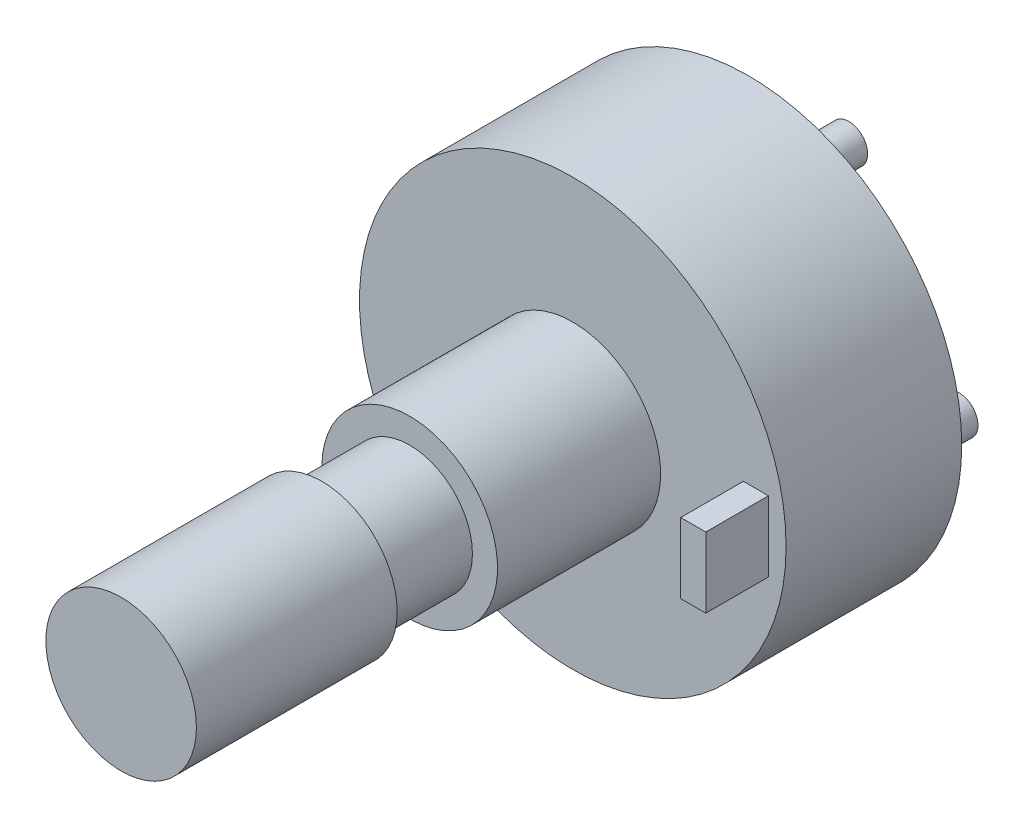
from build123d import *

# Parameters (mm, degrees)
SKETCH_1_R          = 8.5
EXTRUDE_1_DEPTH     = 7
SKETCH_4_W          = 1
SKETCH_4_H          = 2.8
EXTRUDE_4_DEPTH     = 2.5
SKETCH_5_R          = 3.5
EXTRUDE_5_DEPTH     = 6.5
SKETCH_6_R          = 2.5
EXTRUDE_6_DEPTH     = 3.5
SKETCH_7_R          = 3
EXTRUDE_7_DEPTH     = 8
SKETCH_8_R          = 0.75
EXTRUDE_8_DEPTH     = 4
CUT_EXTRUDE_1_DEPTH = 0.1


with BuildPart() as part:
    # Эскиз1 → Вытянуть1 (new body)
    with BuildSketch(Plane.XY):
        Circle(SKETCH_1_R)
    extrude(amount=EXTRUDE_1_DEPTH)

    # Эскиз4 → Вытянуть4 (add)
    with BuildSketch(Plane.XY.offset(7)):
        with Locations((7.3, 0)):
            Rectangle(SKETCH_4_W, SKETCH_4_H)
    extrude(amount=EXTRUDE_4_DEPTH)

    # Эскиз5 → Вытянуть5 (add)
    with BuildSketch(Plane.XY.offset(7)):
        with Locations(Location((0, 0, 0), (0, 0, 180))):
            Circle(SKETCH_5_R)
    extrude(amount=EXTRUDE_5_DEPTH)

    # Эскиз6 → Вытянуть6 (add)
    with BuildSketch(Plane.XY.offset(13.5)):
        Circle(SKETCH_6_R)
    extrude(amount=EXTRUDE_6_DEPTH)

    # Эскиз7 → Вытянуть7 (add)
    with BuildSketch(Plane.XY.offset(17)):
        Circle(SKETCH_7_R)
    extrude(amount=EXTRUDE_7_DEPTH)

    # Эскиз8 → Вытянуть8 (add)
    with BuildSketch(Plane(origin=(0, 0, 0), x_dir=(-1, 0, 0), z_dir=(0, 0, -1))):
        with Locations(Location((0, 4.170637875, 0), (0, 0, 180))):
            Circle(SKETCH_8_R)
        with Locations(Location((4.398665233, -2.996152892, 0), (0, 0, 180))):
            Circle(SKETCH_8_R)
        with Locations(Location((-4.398665233, -2.996152892, 0), (0, 0, 180))):
            Circle(SKETCH_8_R)
    extrude(amount=EXTRUDE_8_DEPTH)

    # Эскиз9 → Вырез-Вытянуть1 (cut)
    with BuildSketch(Plane(origin=(0, 0, 0), x_dir=(-1, 0, 0), z_dir=(0, 0, -1))):
        with BuildLine():
            add(Edge.make_bspline(
                [(2.713797769, -3.972631354), (2.713515603, -3.980128464), (2.71297592, -3.994467774), (2.707695876, -4.014784457), (2.699320857, -4.033055702), (2.690950559, -4.043171243), (2.686770742, -4.04822257)],
                knots=[0, 0, 0, 0, 1.092637599, 2.089827516, 3.046130571, 4, 4, 4, 4], degree=3))
            add(Edge.make_bspline(
                [(2.686770742, -4.04822257), (2.682257107, -4.051930552), (2.673257572, -4.059323731), (2.657035359, -4.067214277), (2.638674751, -4.071153076), (2.625835353, -4.071905073), (2.619203175, -4.072293516)],
                knots=[0, 0, 0, 0, 0.952479984, 1.899107072, 2.914785828, 4, 4, 4, 4], degree=3))
            add(Edge.make_bspline(
                [(2.619203175, -4.072293516), (2.612973782, -4.071971759), (2.600895193, -4.071347884), (2.583488342, -4.066360283), (2.567179902, -4.05878394), (2.552464646, -4.047805267), (2.539755174, -4.033685028), (2.531008825, -4.01586549), (2.52530447, -3.995220353), (2.524848394, -3.980415867), (2.52460858, -3.972631354)],
                knots=[0, 0, 0, 0, 0.965224369, 1.871538615, 2.790145089, 3.742676772, 4.702446452, 5.708824282, 6.795250981, 8, 8, 8, 8], degree=3))
            Line((2.52460858, -3.972631354), (2.52460858, -2.416043516))
            Line((2.52460858, -2.416043516), (2.282209931, -2.645773245))
            add(Edge.make_bspline(
                [(2.282209931, -2.645773245), (2.276900692, -2.650406319), (2.266682327, -2.659323308), (2.248447833, -2.668158896), (2.229582564, -2.674608161), (2.216246052, -2.675092019), (2.209574796, -2.675334056)],
                knots=[0, 0, 0, 0, 1.047830234, 2.016694027, 3.007900926, 4, 4, 4, 4], degree=3))
            add(Edge.make_bspline(
                [(2.209574796, -2.675334056), (2.203327317, -2.675070597), (2.19055066, -2.674531799), (2.171860071, -2.667893796), (2.152969967, -2.658813277), (2.141580254, -2.649948716), (2.135672769, -2.645350948)],
                knots=[0, 0, 0, 0, 0.917779654, 1.876941996, 2.898836826, 4, 4, 4, 4], degree=3))
            add(Edge.make_bspline(
                [(2.135672769, -2.645350948), (2.13065196, -2.640186587), (2.121037938, -2.630297687), (2.110726638, -2.612816415), (2.103879259, -2.594330043), (2.103117491, -2.58136257), (2.10273358, -2.574827299)],
                knots=[0, 0, 0, 0, 1.076594581, 2.061500984, 3.023046599, 4, 4, 4, 4], degree=3))
            add(Edge.make_bspline(
                [(2.10273358, -2.574827299), (2.103206534, -2.569014859), (2.104161096, -2.557283629), (2.110066446, -2.539721294), (2.119858566, -2.522544237), (2.128604791, -2.511921927), (2.133138985, -2.506415137)],
                knots=[0, 0, 0, 0, 0.912890005, 1.842483027, 2.881505822, 4, 4, 4, 4], degree=3))
            Line((2.133138985, -2.506415137), (2.540655877, -2.109455678))
            add(Edge.make_bspline(
                [(2.540655877, -2.109455678), (2.547401488, -2.103347599), (2.560496415, -2.091490281), (2.582312439, -2.077288688), (2.605825737, -2.067044275), (2.622618562, -2.066039764), (2.631027499, -2.065536759)],
                knots=[0, 0, 0, 0, 1.058271981, 2.054372069, 3.025734895, 4, 4, 4, 4], degree=3))
            add(Edge.make_bspline(
                [(2.631027499, -2.065536759), (2.635311683, -2.065856875), (2.644670117, -2.066556141), (2.658565291, -2.07339881), (2.673949136, -2.08250867), (2.683661424, -2.090970983), (2.688882229, -2.095519867)],
                knots=[0, 0, 0, 0, 0.76941324, 1.680717673, 2.753278471, 4, 4, 4, 4], degree=3))
            add(Edge.make_bspline(
                [(2.688882229, -2.095519867), (2.692815035, -2.101001936), (2.70089675, -2.112267309), (2.708074678, -2.132673895), (2.712876615, -2.155257484), (2.713481802, -2.171221987), (2.713797769, -2.179557029)],
                knots=[0, 0, 0, 0, 0.903116982, 1.855859341, 2.880547435, 4, 4, 4, 4], degree=3))
            Line((2.713797769, -2.179557029), (2.713797769, -3.972631354))
        make_face()
        with BuildLine():
            Line((0.641683211, 1.982951696), (-0.004431654, 0.946634129))
            Line((-0.004431654, 0.946634129), (0.614233886, 0.946634129))
            add(Edge.make_bspline(
                [(0.614233886, 0.946634129), (0.620887476, 0.946349382), (0.634012747, 0.945787673), (0.652923053, 0.94010725), (0.670037799, 0.930571412), (0.685212067, 0.917934476), (0.697449599, 0.902971967), (0.707288107, 0.88712087), (0.713009099, 0.869875765), (0.713600093, 0.857991084), (0.713896048, 0.852039534)],
                knots=[0, 0, 0, 0, 1.049035914, 2.069391155, 3.084643979, 4.126821057, 5.168998136, 6.1263312, 7.061713754, 8, 8, 8, 8], degree=3))
            add(Edge.make_bspline(
                [(0.713896048, 0.852039534), (0.712495652, 0.841126977), (0.709523342, 0.817965317), (0.693423108, 0.792035209), (0.675522305, 0.773936077), (0.657673957, 0.764090738), (0.636781872, 0.758715413), (0.622007833, 0.757882965), (0.614233886, 0.757444939)],
                knots=[0, 0, 0, 0, 1.282713716, 2.722531535, 3.483677017, 4.262097154, 5.085533406, 6, 6, 6, 6], degree=3))
            Line((0.614233886, 0.757444939), (-0.183908006, 0.757444939))
            add(Edge.make_bspline(
                [(-0.183908006, 0.757444939), (-0.192372088, 0.757647702), (-0.208271481, 0.758028583), (-0.230581277, 0.76187034), (-0.249722252, 0.767896201), (-0.265520067, 0.776913414), (-0.277641635, 0.788573054), (-0.286551464, 0.802702772), (-0.291591058, 0.819615862), (-0.292146543, 0.831735633), (-0.292438411, 0.838103723)],
                knots=[0, 0, 0, 0, 1.318247643, 2.476267915, 3.517133912, 4.431675526, 5.285213851, 6.113267656, 7.008654443, 8, 8, 8, 8], degree=3))
            add(Edge.make_bspline(
                [(-0.292438411, 0.838103723), (-0.292055365, 0.843622383), (-0.291248119, 0.855252606), (-0.286125741, 0.873223108), (-0.278497025, 0.892739161), (-0.271604396, 0.905876083), (-0.267945168, 0.912850345)],
                knots=[0, 0, 0, 0, 0.834498753, 1.75865294, 2.810090946, 4, 4, 4, 4], degree=3))
            Line((-0.267945168, 0.912850345), (0.479098751, 2.096971966))
            add(Edge.make_bspline(
                [(0.479098751, 2.096971966), (0.484867325, 2.109813061), (0.496132299, 2.13488938), (0.507910628, 2.173284279), (0.514946395, 2.210876619), (0.516111421, 2.235598648), (0.516683211, 2.247732102)],
                knots=[0, 0, 0, 0, 1.077976984, 2.105092662, 3.069988531, 4, 4, 4, 4], degree=3))
            add(Edge.make_bspline(
                [(0.516683211, 2.247732102), (0.516321365, 2.258303389), (0.515603852, 2.279265454), (0.511007365, 2.310193512), (0.502740283, 2.339965331), (0.491921529, 2.368852071), (0.477343944, 2.396336173), (0.459855478, 2.422818733), (0.439082453, 2.448182836), (0.423353408, 2.463937403), (0.415331859, 2.471971966)],
                knots=[0, 0, 0, 0, 1.001356293, 1.985614019, 2.952654674, 3.923273066, 4.901280323, 5.892287325, 6.925101988, 8, 8, 8, 8], degree=3))
            add(Edge.make_bspline(
                [(0.415331859, 2.471971966), (0.39863939, 2.485899454), (0.364787719, 2.514143853), (0.314608129, 2.538944217), (0.271792217, 2.553990902), (0.238063864, 2.562620209), (0.20290237, 2.567198172), (0.179139062, 2.56789858), (0.167021048, 2.56825575)],
                knots=[0, 0, 0, 0, 1.432193878, 2.904432902, 3.663213759, 4.430043462, 5.199406286, 6, 6, 6, 6], degree=3))
            add(Edge.make_bspline(
                [(0.167021048, 2.56825575), (0.154308321, 2.567786875), (0.128936105, 2.566851087), (0.091559916, 2.558690243), (0.054552236, 2.546705487), (0.031445143, 2.53441629), (0.019639292, 2.528137507)],
                knots=[0, 0, 0, 0, 0.986895246, 1.969657644, 2.962659636, 4, 4, 4, 4], degree=3))
            add(Edge.make_bspline(
                [(0.019639292, 2.528137507), (0.008177789, 2.520517249), (-0.014678314, 2.505321213), (-0.045334014, 2.477867872), (-0.073760497, 2.448022055), (-0.089449582, 2.425460006), (-0.09733706, 2.414117237)],
                knots=[0, 0, 0, 0, 1.002390868, 1.998930695, 2.993989149, 4, 4, 4, 4], degree=3))
            add(Edge.make_bspline(
                [(-0.09733706, 2.414117237), (-0.102267744, 2.407763943), (-0.113231001, 2.393637548), (-0.128312215, 2.383966044), (-0.136610708, 2.378644264)],
                knots=[0, 0, 0, 0, 0.899492679, 2, 2, 2, 2], degree=3))
            Line((-0.136610708, 2.378644264), (-0.181374222, 2.368509129))
            add(Edge.make_bspline(
                [(-0.181374222, 2.368509129), (-0.187760199, 2.368775782), (-0.20049607, 2.369307583), (-0.218875418, 2.375476885), (-0.236926912, 2.383599105), (-0.253037684, 2.396094148), (-0.267453079, 2.41031837), (-0.277891592, 2.427231313), (-0.28402344, 2.44594162), (-0.284841361, 2.45897621), (-0.285259357, 2.465637507)],
                knots=[0, 0, 0, 0, 0.970789839, 1.936094272, 2.935708313, 3.980052531, 5.028588703, 6.012606459, 6.984347121, 8, 8, 8, 8], degree=3))
            add(Edge.make_bspline(
                [(-0.285259357, 2.465637507), (-0.284178387, 2.473753677), (-0.281529596, 2.493641407), (-0.272996131, 2.511862541), (-0.267945168, 2.522647642)],
                knots=[0, 0, 0, 0, 0.816198688, 2, 2, 2, 2], degree=3))
            add(Edge.make_bspline(
                [(-0.267945168, 2.522647642), (-0.255988159, 2.539469858), (-0.231959765, 2.573275203), (-0.187799588, 2.617874631), (-0.138263529, 2.658198837), (-0.101306152, 2.680055683), (-0.082556654, 2.691144264)],
                knots=[0, 0, 0, 0, 0.97790503, 1.965164305, 2.967671729, 4, 4, 4, 4], degree=3))
            add(Edge.make_bspline(
                [(-0.082556654, 2.691144264), (-0.063619758, 2.700918376), (-0.0263382, 2.720160923), (0.032116259, 2.74021907), (0.089849986, 2.755140935), (0.128643794, 2.756688783), (0.147595373, 2.757444939)],
                knots=[0, 0, 0, 0, 1.055887345, 2.078752778, 3.061430904, 4, 4, 4, 4], degree=3))
            add(Edge.make_bspline(
                [(0.147595373, 2.757444939), (0.166761417, 2.756941225), (0.204385972, 2.755952392), (0.259838154, 2.748637503), (0.312973966, 2.736389758), (0.364011713, 2.719570477), (0.412521121, 2.697377882), (0.458654977, 2.670160258), (0.502732371, 2.638321143), (0.544186144, 2.602321436), (0.581981117, 2.562923311), (0.615186297, 2.520980211), (0.642971882, 2.476989577), (0.666302447, 2.431329652), (0.683836612, 2.383630097), (0.696667583, 2.334144419), (0.704469765, 2.282749896), (0.705400098, 2.247759278), (0.7058724, 2.229995615)],
                knots=[0, 0, 0, 0, 1.07713943, 2.114515162, 3.137548884, 4.138402978, 5.129829663, 6.129964134, 7.144517493, 8.182134601, 9.211847614, 10.209098401, 11.183711391, 12.132050352, 13.08591865, 14.033960487, 15.001902051, 16, 16, 16, 16], degree=3))
            add(Edge.make_bspline(
                [(0.7058724, 2.229995615), (0.70520168, 2.209377921), (0.703843935, 2.167641302), (0.69065758, 2.105515669), (0.671182974, 2.043013894), (0.651666882, 2.003278682), (0.641683211, 1.982951696)],
                knots=[0, 0, 0, 0, 0.958992559, 1.941298943, 2.946848803, 4, 4, 4, 4], degree=3))
        make_face()
        with BuildLine():
            Line((-2.151452977, -2.214999873), (-2.561081355, -2.214999873))
            add(Edge.make_bspline(
                [(-2.561081355, -2.214999873), (-2.568573533, -2.214700283), (-2.583040075, -2.21412181), (-2.603550422, -2.20899841), (-2.621985504, -2.200408788), (-2.632314857, -2.192138247), (-2.637517166, -2.187972846)],
                knots=[0, 0, 0, 0, 1.082783474, 2.090731409, 3.038409894, 4, 4, 4, 4], degree=3))
            add(Edge.make_bspline(
                [(-2.637517166, -2.187972846), (-2.641558782, -2.183202944), (-2.649566853, -2.173751846), (-2.65725897, -2.156941695), (-2.662875143, -2.139204484), (-2.663419705, -2.126787398), (-2.663699598, -2.120405278)],
                knots=[0, 0, 0, 0, 1.007594706, 1.996451512, 2.970218466, 4, 4, 4, 4], degree=3))
            add(Edge.make_bspline(
                [(-2.663699598, -2.120405278), (-2.663398073, -2.114727532), (-2.662797645, -2.103421443), (-2.657116111, -2.08697271), (-2.649261254, -2.07080113), (-2.637688194, -2.055618143), (-2.623455559, -2.042128182), (-2.605653597, -2.032640348), (-2.585566566, -2.026433723), (-2.571125873, -2.026023858), (-2.563615139, -2.025810684)],
                knots=[0, 0, 0, 0, 0.886426588, 1.765140182, 2.701969987, 3.694250836, 4.73997423, 5.746606742, 6.827989987, 8, 8, 8, 8], degree=3))
            Line((-2.563615139, -2.025810684), (-2.163699598, -2.025810684))
            add(Edge.make_bspline(
                [(-2.163699598, -2.025810684), (-2.144681167, -2.026366033), (-2.107368375, -2.027455588), (-2.052831501, -2.033960272), (-2.001477152, -2.046095265), (-1.95284936, -2.061862476), (-1.907407594, -2.083360273), (-1.864652818, -2.109017762), (-1.824901852, -2.139601834), (-1.801393068, -2.163339627), (-1.789544193, -2.175303927)],
                knots=[0, 0, 0, 0, 1.10007907, 2.158275827, 3.169329497, 4.147569055, 5.10903335, 6.069566678, 7.027024855, 8, 8, 8, 8], degree=3))
            add(Edge.make_bspline(
                [(-1.789544193, -2.175303927), (-1.779425734, -2.187066046), (-1.759444058, -2.210293579), (-1.734288256, -2.248440787), (-1.711892438, -2.287666633), (-1.694319659, -2.329115136), (-1.680645274, -2.372252806), (-1.671007196, -2.417219407), (-1.664981928, -2.463992858), (-1.664129845, -2.495809539), (-1.663699598, -2.511874873)],
                knots=[0, 0, 0, 0, 1.011347742, 1.997183856, 2.975805811, 3.955074047, 4.928163601, 5.924384392, 6.951950476, 8, 8, 8, 8], degree=3))
            add(Edge.make_bspline(
                [(-1.663699598, -2.511874873), (-1.6641799, -2.531347614), (-1.665121931, -2.56954014), (-1.675183691, -2.625490264), (-1.689389839, -2.679297329), (-1.711111797, -2.730390691), (-1.737958788, -2.77929675), (-1.772017788, -2.825151432), (-1.811670341, -2.86904003), (-1.842296376, -2.895091277), (-1.857956355, -2.908412035)],
                knots=[0, 0, 0, 0, 1.020209835, 2.000970977, 2.973611179, 3.933444388, 4.905159373, 5.893119876, 6.922691094, 8, 8, 8, 8], degree=3))
            add(Edge.make_bspline(
                [(-1.857956355, -2.908412035), (-1.844421154, -2.920064227), (-1.816960706, -2.943704392), (-1.780934788, -2.985484026), (-1.748245279, -3.032023179), (-1.718907789, -3.082573394), (-1.694251539, -3.136535007), (-1.676966032, -3.193340026), (-1.665993554, -3.252022721), (-1.664469691, -3.291950526), (-1.663699598, -3.312128251)],
                knots=[0, 0, 0, 0, 0.926315811, 1.879325348, 2.854774747, 3.876528351, 4.910341529, 5.927614713, 6.952709267, 8, 8, 8, 8], degree=3))
            Line((-1.663699598, -3.312128251), (-1.663699598, -3.516097846))
            add(Edge.make_bspline(
                [(-1.663699598, -3.516097846), (-1.664013639, -3.533160636), (-1.664634266, -3.56688119), (-1.672340297, -3.616446561), (-1.683445516, -3.664344245), (-1.699720553, -3.710304539), (-1.720506909, -3.754450762), (-1.746043649, -3.796833969), (-1.776040233, -3.837532648), (-1.810668988, -3.87542341), (-1.847583324, -3.910929449), (-1.887726496, -3.941241126), (-1.928979008, -3.967784121), (-1.972431368, -3.988920369), (-2.01753607, -4.005569226), (-2.064510521, -4.017449246), (-2.11353251, -4.024192646), (-2.146787579, -4.025265221), (-2.163699598, -4.025810684)],
                knots=[0, 0, 0, 0, 1.032030617, 2.03956357, 3.029646226, 4.005320733, 4.985043468, 5.978859951, 6.99639837, 8.040288379, 9.083203961, 10.092249456, 11.080496654, 12.04854917, 13.011071955, 13.986634805, 14.976093788, 16, 16, 16, 16], degree=3))
            Line((-2.163699598, -4.025810684), (-2.563615139, -4.025810684))
            add(Edge.make_bspline(
                [(-2.563615139, -4.025810684), (-2.570817621, -4.025462617), (-2.58481618, -4.024786124), (-2.604790789, -4.020258399), (-2.622818667, -4.012068002), (-2.632876522, -4.004074388), (-2.637939463, -4.000050549)],
                knots=[0, 0, 0, 0, 1.074611043, 2.088586395, 3.037829185, 4, 4, 4, 4], degree=3))
            add(Edge.make_bspline(
                [(-2.637939463, -4.000050549), (-2.641926834, -3.994823984), (-2.649624997, -3.984733389), (-2.65794215, -3.967743694), (-2.662634941, -3.949768568), (-2.663342653, -3.937436142), (-2.663699598, -3.931216089)],
                knots=[0, 0, 0, 0, 1.049924066, 2.027021419, 3.004897233, 4, 4, 4, 4], degree=3))
            add(Edge.make_bspline(
                [(-2.663699598, -3.931216089), (-2.662337125, -3.920290288), (-2.659451386, -3.897149274), (-2.642795749, -3.871357774), (-2.624396443, -3.853725797), (-2.606671726, -3.843054964), (-2.585280339, -3.837952088), (-2.570251276, -3.837080054), (-2.562348247, -3.836621495)],
                knots=[0, 0, 0, 0, 1.272750596, 2.69570531, 3.462819016, 4.243362811, 5.076272775, 6, 6, 6, 6], degree=3))
            Line((-2.562348247, -3.836621495), (-2.156942842, -3.836621495))
            add(Edge.make_bspline(
                [(-2.156942842, -3.836621495), (-2.146645672, -3.836457612), (-2.126222509, -3.836132571), (-2.096428005, -3.83114813), (-2.067636492, -3.824096213), (-2.040207013, -3.813666916), (-2.013349779, -3.801389051), (-1.988476775, -3.784770224), (-1.964183063, -3.766332213), (-1.934216884, -3.73778534), (-1.901832957, -3.697688462), (-1.873494561, -3.643486177), (-1.855722885, -3.584483978), (-1.853846051, -3.543391278), (-1.852888788, -3.522432305)],
                knots=[0, 0, 0, 0, 0.762142209, 1.511614757, 2.232672098, 2.955462843, 3.683354291, 4.415419634, 5.166560015, 5.941375375, 7.477641641, 8.961410111, 10.450193738, 12, 12, 12, 12], degree=3))
            Line((-1.852888788, -3.522432305), (-1.852888788, -3.312972846))
            add(Edge.make_bspline(
                [(-1.852888788, -3.312972846), (-1.853910978, -3.292173539), (-1.85591982, -3.251298061), (-1.872828495, -3.192339379), (-1.901604244, -3.13862372), (-1.933557821, -3.098396808), (-1.96320147, -3.069674533), (-1.987291157, -3.050758656), (-2.012573436, -3.03468165), (-2.039336467, -3.02152555), (-2.067367294, -3.011280446), (-2.096722145, -3.004306595), (-2.12720807, -2.999243728), (-2.148052866, -2.998938544), (-2.158632031, -2.998783657)],
                knots=[0, 0, 0, 0, 1.533728977, 3.01413434, 4.483223777, 6.007344777, 6.786470932, 7.526637132, 8.264757458, 8.994488945, 9.724368435, 10.46292764, 11.219904006, 12, 12, 12, 12], degree=3))
            Line((-2.158632031, -2.998783657), (-2.362601626, -2.998783657))
            add(Edge.make_bspline(
                [(-2.362601626, -2.998783657), (-2.36994563, -2.998437067), (-2.384223961, -2.997763222), (-2.404594608, -2.993212236), (-2.422990498, -2.985161585), (-2.433136205, -2.977060911), (-2.438192842, -2.973023522)],
                knots=[0, 0, 0, 0, 1.079228925, 2.098254295, 3.052166909, 4, 4, 4, 4], degree=3))
            add(Edge.make_bspline(
                [(-2.438192842, -2.973023522), (-2.44219329, -2.967800546), (-2.4499167, -2.957716881), (-2.458070614, -2.940644235), (-2.463441778, -2.922815417), (-2.464062929, -2.910421394), (-2.464375274, -2.904189062)],
                knots=[0, 0, 0, 0, 1.048365217, 2.024011849, 3.006374687, 4, 4, 4, 4], degree=3))
            add(Edge.make_bspline(
                [(-2.464375274, -2.904189062), (-2.463044791, -2.893239704), (-2.460217812, -2.869974763), (-2.44301042, -2.844477076), (-2.424546341, -2.826411504), (-2.406228374, -2.816248378), (-2.384441131, -2.810806324), (-2.369108233, -2.810016596), (-2.360912436, -2.809594468)],
                knots=[0, 0, 0, 0, 1.258100478, 2.673182502, 3.431466272, 4.231225732, 5.054548406, 6, 6, 6, 6], degree=3))
            Line((-2.360912436, -2.809594468), (-2.154409058, -2.809594468))
            add(Edge.make_bspline(
                [(-2.154409058, -2.809594468), (-2.14313958, -2.809199582), (-2.121085293, -2.808426793), (-2.088728464, -2.804441025), (-2.058186059, -2.796456601), (-2.028790513, -2.786658492), (-2.001177657, -2.772814167), (-1.975096838, -2.756318552), (-1.950084038, -2.73734357), (-1.935473452, -2.722242348), (-1.928057707, -2.714577576)],
                knots=[0, 0, 0, 0, 1.070147729, 2.094271507, 3.085807588, 4.061830826, 5.029773958, 6.008354147, 6.989120704, 8, 8, 8, 8], degree=3))
            add(Edge.make_bspline(
                [(-1.928057707, -2.714577576), (-1.916458037, -2.699916788), (-1.893416233, -2.670794321), (-1.869763446, -2.619776358), (-1.855348299, -2.564333691), (-1.853723036, -2.525761712), (-1.852888788, -2.505962711)],
                knots=[0, 0, 0, 0, 0.987024596, 1.960644339, 2.953198527, 4, 4, 4, 4], degree=3))
            add(Edge.make_bspline(
                [(-1.852888788, -2.505962711), (-1.85380081, -2.486603864), (-1.855567428, -2.449105141), (-1.868668265, -2.395314053), (-1.891747516, -2.346887555), (-1.913700165, -2.319494074), (-1.924679328, -2.305793792)],
                knots=[0, 0, 0, 0, 1.067567691, 2.067913768, 3.033707067, 4, 4, 4, 4], degree=3))
            add(Edge.make_bspline(
                [(-1.924679328, -2.305793792), (-1.931718963, -2.29860691), (-1.945700957, -2.284332457), (-1.969100813, -2.265597155), (-1.994621695, -2.249839396), (-2.022367713, -2.23722798), (-2.051893309, -2.227038108), (-2.083461333, -2.21988493), (-2.116845412, -2.215600793), (-2.139756396, -2.21520297), (-2.151452977, -2.214999873)],
                knots=[0, 0, 0, 0, 0.95779418, 1.902353299, 2.8476737, 3.807718427, 4.800094425, 5.818320437, 6.886202787, 8, 8, 8, 8], degree=3))
        make_face()
    extrude(amount=-CUT_EXTRUDE_1_DEPTH, mode=Mode.SUBTRACT)


solid = part.part
